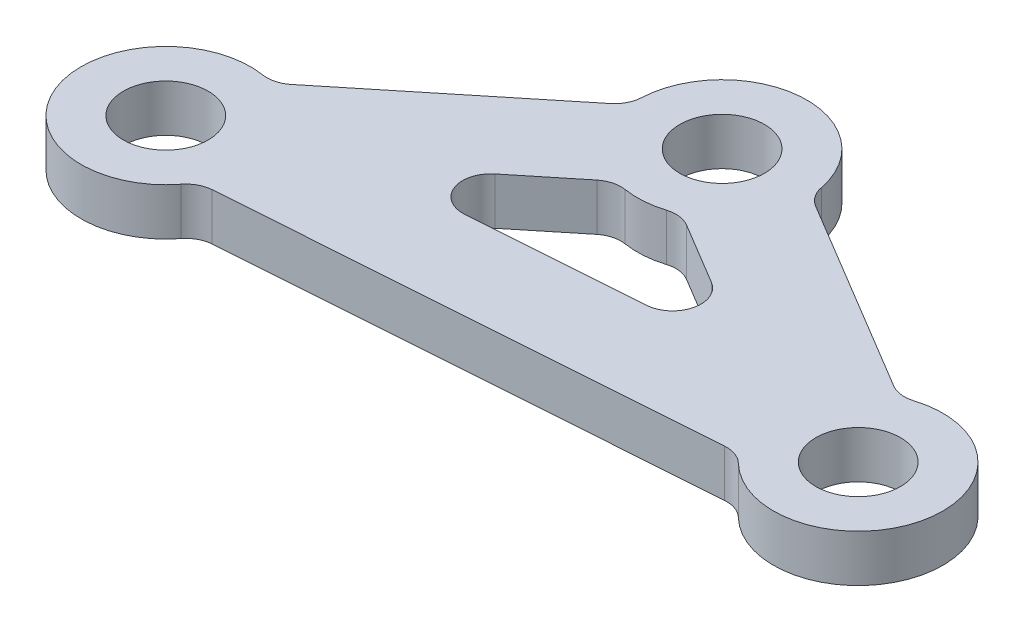
from build123d import *

# Parameters (mm, degrees)
SKETCH_1_R      = 4.5
EXTRUDE_1_DEPTH = 5


with BuildPart() as part:
    # 草图1 → 凸台-拉伸1 (new body)
    with BuildSketch(Plane(origin=(0, 0, 0), x_dir=(1, 0, 0), z_dir=(0, 1, 0))):
        with BuildLine():
            Line((-24.529804943, -13.414912777), (26.261252101, -9.790256419))
            ThreePointArc((26.261252101, -9.790256419), (27.501496461, -9.963799505), (28.562830813, -10.628549584))
            ThreePointArc((28.562830813, -10.628549584), (43.581244656, -6.254750357), (32.154801632, 4.427911945))
            ThreePointArc((32.154801632, 4.427911945), (30.907676626, 4.313883471), (29.722660532, 4.718926844))
            Line((29.722660532, 4.718926844), (9.037370221, 17.10767512))
            ThreePointArc((9.037370221, 17.10767512), (8.120961743, 17.961208234), (7.63285252, 19.114495996))
            ThreePointArc((7.63285252, 19.114495996), (-1.845653191, 26.39100116), (-10.194803688, 17.842241957))
            ThreePointArc((-10.194803688, 17.842241957), (-10.514193846, 16.631327756), (-11.300109489, 15.656309871))
            Line((-11.300109489, 15.656309871), (-30.016510781, 0.455696667))
            ThreePointArc((-30.016510781, 0.455696667), (-31.131999709, -0.113520099), (-32.382678895, -0.177745089))
            ThreePointArc((-32.382678895, -0.177745089), (-42.176335122, -12.374759959), (-26.689017586, -14.571546152))
            ThreePointArc((-26.689017586, -14.571546152), (-25.732836633, -13.762817978), (-24.529804943, -13.414912777))
        make_face()
        with Locations(Location((34.826919636, -4.166259648, 0), (0, 0, 270))):
            Circle(SKETCH_1_R, mode=Mode.SUBTRACT)
        with Locations(Location((-1.205005877, 17.413831728, 0), (0, 0, 270))):
            Circle(SKETCH_1_R, mode=Mode.SUBTRACT)
        with Locations(Location((-33.807302827, -9.064276845, 0), (0, 0, 270))):
            Circle(SKETCH_1_R, mode=Mode.SUBTRACT)
        with BuildLine():
            Line((-8.854823413, -2.270850546), (9.162609873, -0.985053244))
            ThreePointArc((9.162609873, -0.985053244), (11.867169109, 1.311172997), (10.490495867, 4.581045532))
            Line((10.490495867, 4.581045532), (3.899253226, 8.528645235))
            ThreePointArc((3.899253226, 8.528645235), (2.714237133, 8.933688608), (1.467112127, 8.819660134))
            ThreePointArc((1.467112127, 8.819660134), (-0.564358564, 8.436662295), (-2.62962981, 8.527299972))
            ThreePointArc((-2.62962981, 8.527299972), (-3.880308996, 8.463074982), (-4.995797924, 7.893858216))
            Line((-4.995797924, 7.893858216), (-10.959665987, 3.050274761))
            ThreePointArc((-10.959665987, 3.050274761), (-11.85804995, -0.381955107), (-8.854823413, -2.270850546))
        make_face(mode=Mode.SUBTRACT)
    extrude(amount=EXTRUDE_1_DEPTH)


solid = part.part
